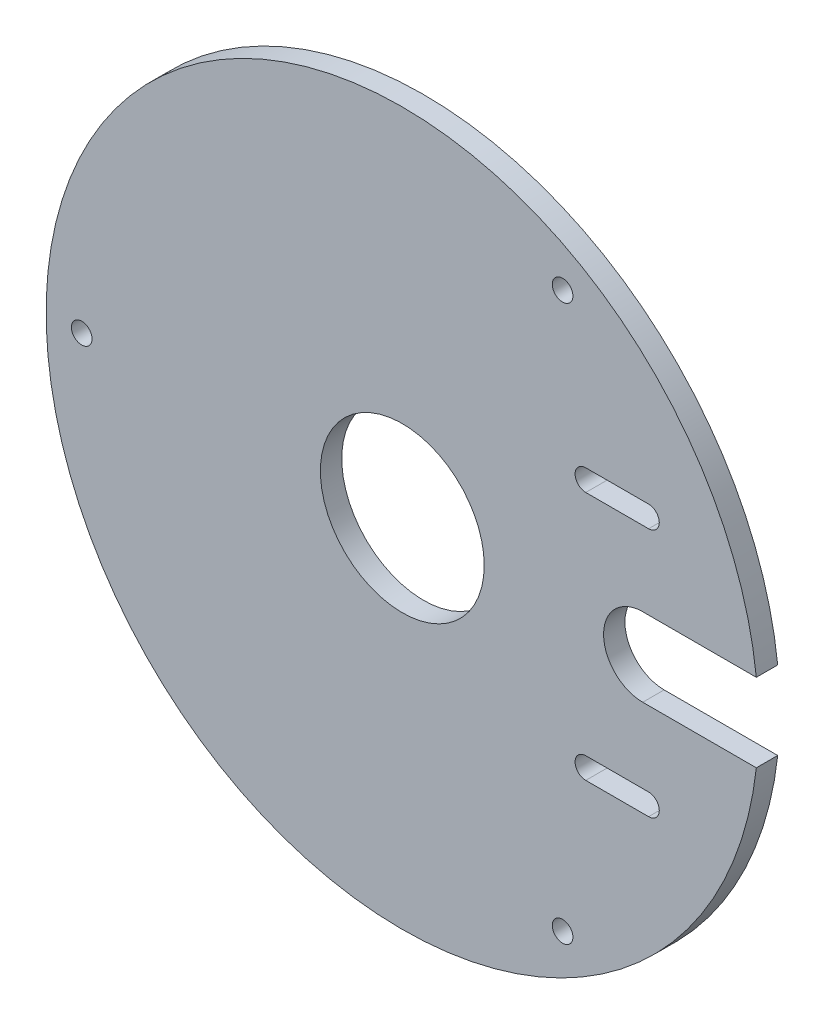
from build123d import *

# Parameters (mm, degrees)
ESQUISSE1_R                  = 50
ESQUISSE1_R_2                = 11.5
BOSS_EXTRU_1_DEPTH           = 3
ENL_V_MAT_EXTRU_2_DEPTH      = 4
ESQUISSE4_R                  = 1.45
ENL_V_MAT_EXTRU_3_DEPTH      = 71.774289117
R_P_TITION_CIRCULAIRE1_COUNT = 3


with BuildPart() as part:
    # Esquisse1 → Boss.-Extru.1 (new body)
    with BuildSketch(Plane.XY):
        Circle(ESQUISSE1_R)
        Circle(ESQUISSE1_R_2, mode=Mode.SUBTRACT)
    extrude(amount=BOSS_EXTRU_1_DEPTH)

    # Esquisse3 → Enlèv. mat.-Extru.2 (cut)
    with BuildSketch(Plane(origin=(0, 0, 0), x_dir=(-1, 0, 0), z_dir=(0, 0, -1))):
        with BuildLine():
            Line((-50.492676186, 5.5), (-33.753889757, 5.5))
            ThreePointArc((-33.753889757, 5.5), (-28.253889757, 0), (-33.753889757, -5.5))
            Line((-33.753889757, -5.5), (-50.492676186, -5.5))
            ThreePointArc((-50.492676186, -5.5), (-55.992676186, 0), (-50.492676186, 5.5))
        make_face()
        with BuildLine():
            Line((-34.573554166, 19), (-25.753889757, 19))
            ThreePointArc((-25.753889757, 19), (-24.253889757, 17.5), (-25.753889757, 16))
            Line((-25.753889757, 16), (-34.573554166, 16))
            ThreePointArc((-34.573554166, 16), (-36.073554166, 17.5), (-34.573554166, 19))
        make_face()
        with BuildLine():
            Line((-34.573554166, -19), (-25.753889757, -19))
            ThreePointArc((-25.753889757, -19), (-24.253889757, -17.5), (-25.753889757, -16))
            Line((-25.753889757, -16), (-34.573554166, -16))
            ThreePointArc((-34.573554166, -16), (-36.073554166, -17.5), (-34.573554166, -19))
        make_face()
    extrude(amount=-ENL_V_MAT_EXTRU_2_DEPTH, mode=Mode.SUBTRACT)

    # Esquisse4 → Enlèv. mat.-Extru.3 (cut, through all)
    with BuildSketch(Plane.XY):
        with Locations((-45, 0)):
            Circle(ESQUISSE4_R)
    enl_v_mat_extru_3 = extrude(amount=ENL_V_MAT_EXTRU_3_DEPTH, mode=Mode.SUBTRACT)

    # Répétition circulaire1: Enlèv. mat.-Extru.3 ×3 about axis
    r_p_tition_circulaire1_axis = Axis((0, 0, 3), (0, 0, -1))
    for i in range(1, R_P_TITION_CIRCULAIRE1_COUNT):
        add(enl_v_mat_extru_3.rotate(r_p_tition_circulaire1_axis, i * 360 / R_P_TITION_CIRCULAIRE1_COUNT), mode=Mode.SUBTRACT)


solid = part.part
